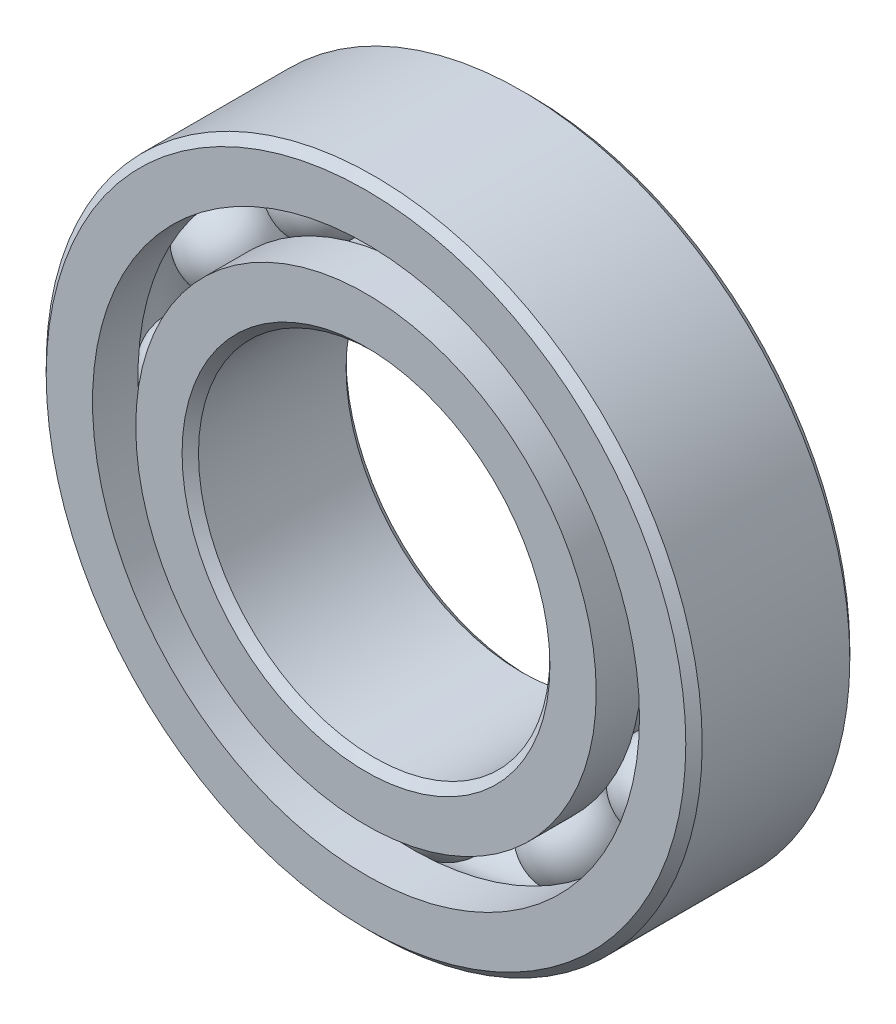
from build123d import *

# Parameters (mm, degrees)
CIRPATTERN1_COUNT = 12


with BuildPart() as part:
    # Sketch1 → Revolve1 (revolve)
    with BuildSketch(Plane(origin=(0, 0, 0), x_dir=(0, 0, -1), z_dir=(1, 0, 0))):
        with BuildLine():
            Line((3.15, 14), (-3.15, 14))
            Line((-3.15, 14), (-3.5, 13.65))
            Line((-3.5, 13.65), (-3.5, 11.673076923))
            Line((-3.5, 11.673076923), (-1.555555556, 11.673076923))
            ThreePointArc((-1.555555556, 11.673076923), (0, 12.558818424), (1.555555556, 11.673076923))
            Line((1.555555556, 11.673076923), (3.5, 11.673076923))
            Line((3.5, 11.673076923), (3.5, 13.65))
            Line((3.5, 13.65), (3.15, 14))
        make_face()
    revolve(axis=Axis((0, 0, 3.5), (0, 0, -1)))


with BuildPart() as body_2:
    # Sketch3 → Revolve3 (revolve)
    with BuildSketch(Plane(origin=(0, 0, 0), x_dir=(0, 0, -1), z_dir=(1, 0, 0))):
        with BuildLine():
            Line((-3.5, 9.826923077), (-1.555555556, 9.826923077))
            ThreePointArc((-1.555555556, 9.826923077), (0, 8.941181576), (1.555555556, 9.826923077))
            Line((1.555555556, 9.826923077), (3.5, 9.826923077))
            Line((3.5, 9.826923077), (3.5, 7.85))
            Line((3.5, 7.85), (3.15, 7.5))
            Line((3.15, 7.5), (-3.15, 7.5))
            Line((-3.15, 7.5), (-3.5, 7.85))
            Line((-3.5, 7.85), (-3.5, 9.826923077))
        make_face()
    revolve(axis=Axis((0, 0, 3.5), (0, 0, -1)))


with BuildPart() as body_3:
    # Sketch4 → Revolve4 (revolve)
    with BuildSketch(Plane(origin=(0, 0, 0), x_dir=(0, 0, -1), z_dir=(1, 0, 0))):
        with BuildLine():
            Line((-1.808818424, 10.75), (1.808818424, 10.75))
            ThreePointArc((1.808818424, 10.75), (0, 12.558818424), (-1.808818424, 10.75))
        make_face()
    revolve(axis=Axis((0, 10.75, 1.808818424), (0, 0, -1)))


with BuildPart() as cirpattern1_1:
    # CirPattern1: pattern copy
    add(body_3.part.rotate(Axis((0, 0, -3.5), (0, 0, 1)), 1 * 360 / CIRPATTERN1_COUNT))


with BuildPart() as cirpattern1_2:
    # CirPattern1: pattern copy
    add(body_3.part.rotate(Axis((0, 0, -3.5), (0, 0, 1)), 2 * 360 / CIRPATTERN1_COUNT))


with BuildPart() as cirpattern1_3:
    # CirPattern1: pattern copy
    add(body_3.part.rotate(Axis((0, 0, -3.5), (0, 0, 1)), 3 * 360 / CIRPATTERN1_COUNT))


with BuildPart() as cirpattern1_4:
    # CirPattern1: pattern copy
    add(body_3.part.rotate(Axis((0, 0, -3.5), (0, 0, 1)), 4 * 360 / CIRPATTERN1_COUNT))


with BuildPart() as cirpattern1_5:
    # CirPattern1: pattern copy
    add(body_3.part.rotate(Axis((0, 0, -3.5), (0, 0, 1)), 5 * 360 / CIRPATTERN1_COUNT))


with BuildPart() as cirpattern1_6:
    # CirPattern1: pattern copy
    add(body_3.part.rotate(Axis((0, 0, -3.5), (0, 0, 1)), 6 * 360 / CIRPATTERN1_COUNT))


with BuildPart() as cirpattern1_7:
    # CirPattern1: pattern copy
    add(body_3.part.rotate(Axis((0, 0, -3.5), (0, 0, 1)), 7 * 360 / CIRPATTERN1_COUNT))


with BuildPart() as cirpattern1_8:
    # CirPattern1: pattern copy
    add(body_3.part.rotate(Axis((0, 0, -3.5), (0, 0, 1)), 8 * 360 / CIRPATTERN1_COUNT))


with BuildPart() as cirpattern1_9:
    # CirPattern1: pattern copy
    add(body_3.part.rotate(Axis((0, 0, -3.5), (0, 0, 1)), 9 * 360 / CIRPATTERN1_COUNT))


with BuildPart() as cirpattern1_10:
    # CirPattern1: pattern copy
    add(body_3.part.rotate(Axis((0, 0, -3.5), (0, 0, 1)), 10 * 360 / CIRPATTERN1_COUNT))


with BuildPart() as cirpattern1_11:
    # CirPattern1: pattern copy
    add(body_3.part.rotate(Axis((0, 0, -3.5), (0, 0, 1)), 11 * 360 / CIRPATTERN1_COUNT))


solid = Compound([part.part, body_2.part, body_3.part, cirpattern1_1.part, cirpattern1_2.part, cirpattern1_3.part, cirpattern1_4.part, cirpattern1_5.part, cirpattern1_6.part, cirpattern1_7.part, cirpattern1_8.part, cirpattern1_9.part, cirpattern1_10.part, cirpattern1_11.part])
